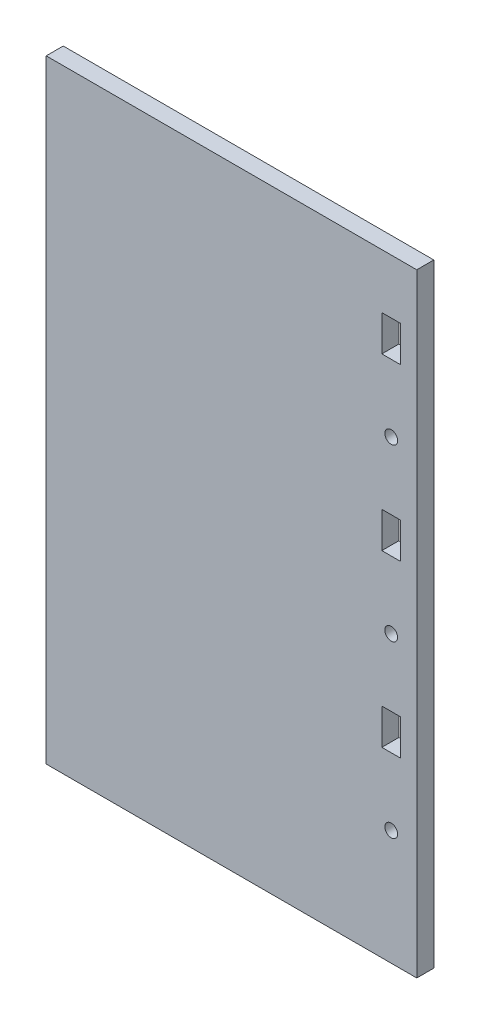
from build123d import *

# Parameters (mm, degrees)
SKETCH_1_R      = 1.5
SKETCH_1_W      = 4.4
SKETCH_1_H      = 8.4
EXTRUDE_1_DEPTH = 4
SKETCH_2_W      = 87
SKETCH_2_H      = 20
EXTRUDE_2_DEPTH = 4


with BuildPart() as part:
    # 草图1 → 凸台-拉伸1 (new body)
    with BuildSketch(Plane.XY):
        Polygon((43.5, -50), (43.5, -150), (43.5, -154), (-43.5, -154), (-43.5, -150), (-43.5, -50), (-43.5, -30), (43.5, -30), align=None)
        with Locations((37.5, -147)):
            Circle(SKETCH_1_R, mode=Mode.SUBTRACT)
        with Locations((37.5, -67)):
            Circle(SKETCH_1_R, mode=Mode.SUBTRACT)
        with Locations((37.5, -107)):
            Circle(SKETCH_1_R, mode=Mode.SUBTRACT)
        with Locations((37.5, -127)):
            Rectangle(SKETCH_1_W, SKETCH_1_H, mode=Mode.SUBTRACT)
        with Locations((37.5, -87)):
            Rectangle(SKETCH_1_W, SKETCH_1_H, mode=Mode.SUBTRACT)
        with Locations((37.5, -47)):
            Rectangle(SKETCH_1_W, SKETCH_1_H, mode=Mode.SUBTRACT)
    extrude(amount=EXTRUDE_1_DEPTH)

    # 草图2 → 凸台-拉伸2 (add)
    with BuildSketch(Plane.XY.offset(4)):
        with Locations((0, -164)):
            Rectangle(SKETCH_2_W, SKETCH_2_H)
    extrude(amount=-EXTRUDE_2_DEPTH)


solid = part.part
